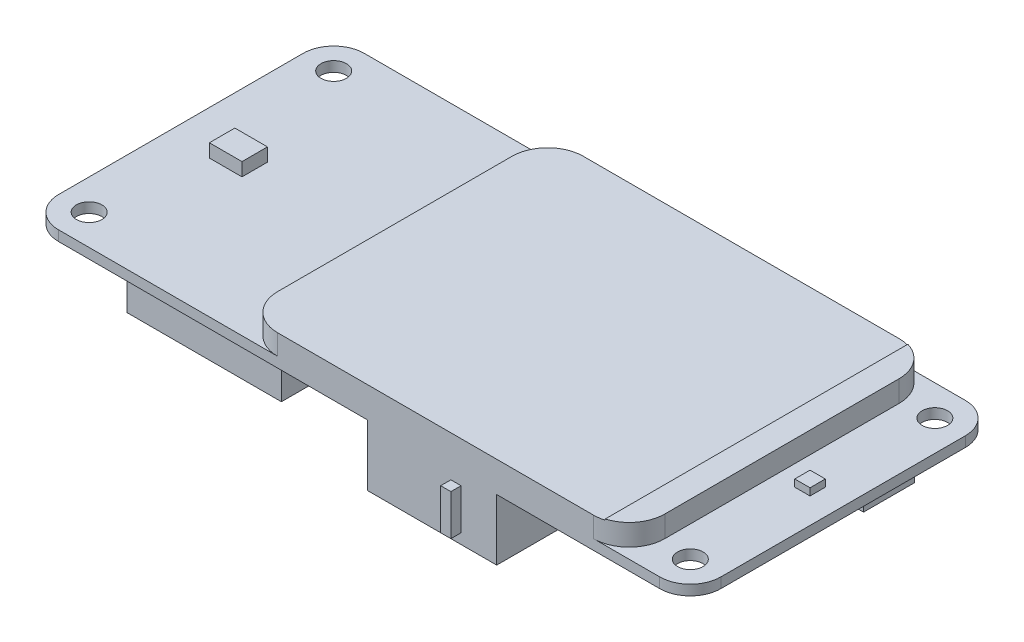
from build123d import *

# Parameters (mm, degrees)
SKETCH_1_R       = 1.25
BOARD_DEPTH      = 1
SKETCH_2_W       = 38
SKETCH_2_H       = 30
SCREEN_DEPTH     = 2
SCREEN_RADIUS_R  = 3.5
SKETCH_3_W       = 51
SKETCH_3_H       = 5
PLUG_DEPTH       = 7.5
SKETCH_4_W       = 15.14
SKETCH_4_H       = 20
SPEAKER_DEPTH    = 5
SKETCH_5_W       = 12.7
SKETCH_5_H       = 6
BUTTON_DEPTH     = 6
SKETCH_6_W       = 1
SKETCH_6_H       = 4
BUTTON_TAP_DEPTH = 1
SKETCH_7_W       = 1.5
SKETCH_7_H       = 1.5
RGB_LED_DEPTH    = 0.7
SKETCH_8_W       = 3.2
SKETCH_8_H       = 2.5
MIC_DEPTH        = 1.3
EXTRUDE_START    = 0.1
EXTRUDE_1_DEPTH  = 0.1


with BuildPart() as part:
    # 草图1 → board (new body)
    with BuildSketch(Plane(origin=(0, 0, 0), x_dir=(1, 0, 0), z_dir=(0, 1, 0))):
        with BuildLine():
            Line((-29.5, 15), (29.5, 15))
            ThreePointArc((29.5, 15), (31.621320344, 14.121320344), (32.5, 12))
            Line((32.5, 12), (32.5, -12))
            ThreePointArc((32.5, -12), (31.621320344, -14.121320344), (29.5, -15))
            Line((29.5, -15), (-29.5, -15))
            ThreePointArc((-29.5, -15), (-31.621320344, -14.121320344), (-32.5, -12))
            Line((-32.5, -12), (-32.5, 12))
            ThreePointArc((-32.5, 12), (-31.621320344, 14.121320344), (-29.5, 15))
        make_face()
        with Locations(Location((-29.5, 12, 0), (0, 0, 270))):
            Circle(SKETCH_1_R, mode=Mode.SUBTRACT)
        with Locations(Location((29.5, 12, 0), (0, 0, 270))):
            Circle(SKETCH_1_R, mode=Mode.SUBTRACT)
        with Locations(Location((-29.5, -12, 0), (0, 0, 270))):
            Circle(SKETCH_1_R, mode=Mode.SUBTRACT)
        with Locations(Location((29.5, -12, 0), (0, 0, 270))):
            Circle(SKETCH_1_R, mode=Mode.SUBTRACT)
    extrude(amount=BOARD_DEPTH)

    # 草图2 → screen (add)
    with BuildSketch(Plane(origin=(0, 1, 0), x_dir=(1, 0, 0), z_dir=(0, 1, 0))):
        with Locations((7.5, 0)):
            Rectangle(SKETCH_2_W, SKETCH_2_H)
    extrude(amount=SCREEN_DEPTH)

    # screen-radius
    screen_radius_edges = [part.edges().sort_by_distance(p)[0] for p in [
        (-11.5, 2, -15),
        (-11.5, 2, 15),
        (26.5, 2, 15),
        (26.5, 2, -15),
    ]]
    fillet(screen_radius_edges, radius=SCREEN_RADIUS_R)

    # 草图3 → plug (add)
    with BuildSketch(Plane.XZ):
        with Locations((0, -11.5)):
            Rectangle(SKETCH_3_W, SKETCH_3_H)
    extrude(amount=PLUG_DEPTH)

    # 草图4 → speaker (add)
    with BuildSketch(Plane.XZ):
        with Locations((-17.52, 2.68)):
            Rectangle(SKETCH_4_W, SKETCH_4_H)
    extrude(amount=SPEAKER_DEPTH)

    # 草图5 → button (add)
    with BuildSketch(Plane.XZ):
        with Locations((7.15, 12)):
            Rectangle(SKETCH_5_W, SKETCH_5_H)
    extrude(amount=BUTTON_DEPTH)

    # 草图6 → button-tap (add)
    with BuildSketch(Plane.XY.offset(15)):
        with Locations((9.5, -3)):
            Rectangle(SKETCH_6_W, SKETCH_6_H)
    extrude(amount=BUTTON_TAP_DEPTH)

    # 草图7 → rgb-led (add)
    with BuildSketch(Plane(origin=(0, 1, 0), x_dir=(1, 0, 0), z_dir=(0, 1, 0))):
        with Locations((29.25, 0)):
            Rectangle(SKETCH_7_W, SKETCH_7_H)
    extrude(amount=RGB_LED_DEPTH)

    # 草图8 → mic (add)
    with BuildSketch(Plane(origin=(0, 1, 0), x_dir=(1, 0, 0), z_dir=(0, 1, 0))):
        with Locations((-26.6, -0.25)):
            Rectangle(SKETCH_8_W, SKETCH_8_H)
    extrude(amount=MIC_DEPTH)

    # 草图9 → 凸台-拉伸1 (add)
    with BuildSketch(Plane(origin=(0, 3, 0), x_dir=(1, 0, 0), z_dir=(0, 1, 0)).offset(EXTRUDE_START)):
        with BuildLine():
            Line((26.5, -11.5), (26.5, 11.5))
            ThreePointArc((26.5, 11.5), (25.80624304, 13.591650066), (24, 14.854101966))
            Line((24, 14.854101966), (24, -14.854101966))
            ThreePointArc((24, -14.854101966), (25.80624304, -13.591650066), (26.5, -11.5))
        make_face()
    extrude(amount=-EXTRUDE_1_DEPTH)


solid = part.part
